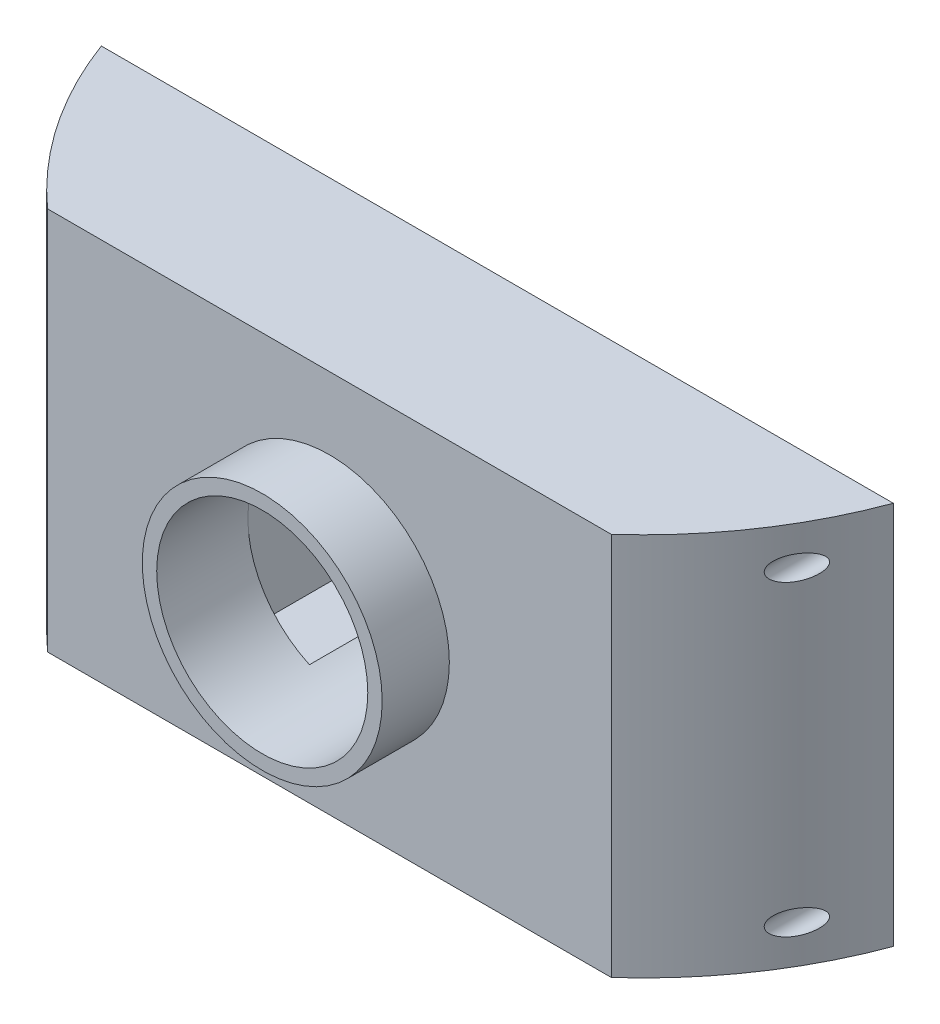
from build123d import *

# Parameters (mm, degrees)
SKETCH_1_W           = 85
SKETCH_1_H           = 40
EXTRUDE_1_DEPTH      = 17.5
SKETCH_2_W           = 54
SKETCH_2_H           = 20
CUT_EXTRUDE_1_DEPTH  = 4
SKETCH_3_R           = 11
CUT_EXTRUDE_2_DEPTH  = 96.557574268
SKETCH_4_W           = 41
SKETCH_4_H           = 20
CUT_EXTRUDE_3_DEPTH  = 15
CUT_EXTRUDE_4_DEPTH  = 40
SKETCH_10_R          = 2
CUT_EXTRUDE_7_DEPTH  = 3
SKETCH_8_R           = 12.5
SKETCH_8_R_2         = 11
EXTRUDE_2_DEPTH      = 7
SKETCH_12_R          = 1.25
CUT_EXTRUDE_10_DEPTH = 97.007972017


with BuildPart() as part:
    # Эскиз1 → Бобышка-Вытянуть1 (new body)
    with BuildSketch(Plane.XY):
        with Locations((42.5, -20)):
            Rectangle(SKETCH_1_W, SKETCH_1_H)
    extrude(amount=EXTRUDE_1_DEPTH)

    # Эскиз2 → Вырез-Вытянуть1 (cut)
    with BuildSketch(Plane.XY):
        with Locations((52.5, -20)):
            Rectangle(SKETCH_2_W, SKETCH_2_H)
    extrude(amount=CUT_EXTRUDE_1_DEPTH, mode=Mode.SUBTRACT)

    # Эскиз3 → Вырез-Вытянуть2 (cut, through all)
    with BuildSketch(Plane.XY):
        with Locations(Location((42.5, -20, 0), (0, 0, 245.380022671))):
            Circle(SKETCH_3_R)
    extrude(amount=CUT_EXTRUDE_2_DEPTH, mode=Mode.SUBTRACT)

    # Эскиз4 → Вырез-Вытянуть3 (cut)
    with BuildSketch(Plane.XY):
        with Locations((52, -20)):
            Rectangle(SKETCH_4_W, SKETCH_4_H)
    extrude(amount=CUT_EXTRUDE_3_DEPTH, mode=Mode.SUBTRACT)

    # Эскиз6 → Вырез-Вытянуть4 (cut)
    with BuildSketch(Plane.XZ.offset(40)):
        with BuildLine():
            Line((0, 17.5), (13.126280648, 17.5))
            ThreePointArc((13.126280648, 17.5), (6.110875281, 9.475733473), (1.230789124, 0))
            Line((1.230789124, 0), (0, 0))
            Line((0, 0), (0, 17.5))
        make_face()
        with BuildLine():
            Line((71.873719352, 17.5), (85, 17.5))
            Line((85, 17.5), (85, 0))
            Line((85, 0), (83.769210876, 0))
            ThreePointArc((83.769210876, 0), (78.889124719, 9.475733473), (71.873719352, 17.5))
        make_face()
    extrude(amount=-CUT_EXTRUDE_4_DEPTH, mode=Mode.SUBTRACT)

    # Эскиз10 → Вырез-Вытянуть7 (cut)
    with BuildSketch(Plane(origin=(0, 0, 4), x_dir=(-1, 0, 0), z_dir=(0, 0, -1))):
        with Locations((-28.5, -15)):
            Circle(SKETCH_10_R)
        with Locations((-28.5, -25)):
            Circle(SKETCH_10_R)
        with Locations((-76.5, -15)):
            Circle(SKETCH_10_R)
        with Locations((-76.5, -25)):
            Circle(SKETCH_10_R)
    extrude(amount=-CUT_EXTRUDE_7_DEPTH, mode=Mode.SUBTRACT)

    # Эскиз8 → Бобышка-Вытянуть2 (add)
    with BuildSketch(Plane.XY.offset(17.5)):
        with Locations((42.5, -20)):
            Circle(SKETCH_8_R)
        with Locations(Location((42.5, -20, 0), (0, 0, 180))):
            Circle(SKETCH_8_R_2, mode=Mode.SUBTRACT)
    extrude(amount=EXTRUDE_2_DEPTH)

    # Эскиз12 → Вырез-Вытянуть10 (cut, through all)
    with BuildSketch(Plane.XY):
        with Locations(Location((80.5, -4, 0), (0, 0, 180))):
            Circle(SKETCH_12_R)
        with Locations(Location((80.5, -36, 0), (0, 0, 180))):
            Circle(SKETCH_12_R)
        with Locations(Location((4.5, -36, 0), (0, 0, 180))):
            Circle(SKETCH_12_R)
        with Locations(Location((4.5, -4, 0), (0, 0, 180))):
            Circle(SKETCH_12_R)
    extrude(amount=CUT_EXTRUDE_10_DEPTH, mode=Mode.SUBTRACT)


solid = part.part
